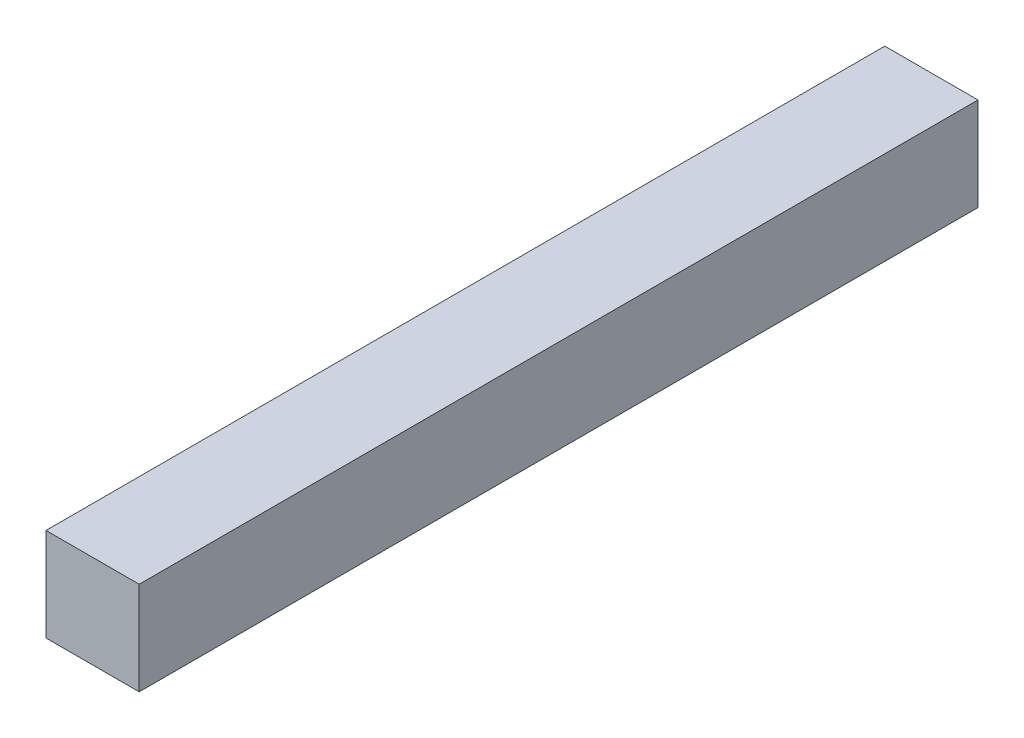
from build123d import *

# Parameters (mm, degrees)
SKETCH_1_W      = 20
SKETCH_1_H      = 20
EXTRUDE_1_DEPTH = 180


with BuildPart() as part:
    # 草圖1 → 填料-伸長1 (new body)
    with BuildSketch(Plane.XY):
        Rectangle(SKETCH_1_W, SKETCH_1_H)
    extrude(amount=EXTRUDE_1_DEPTH)


solid = part.part
